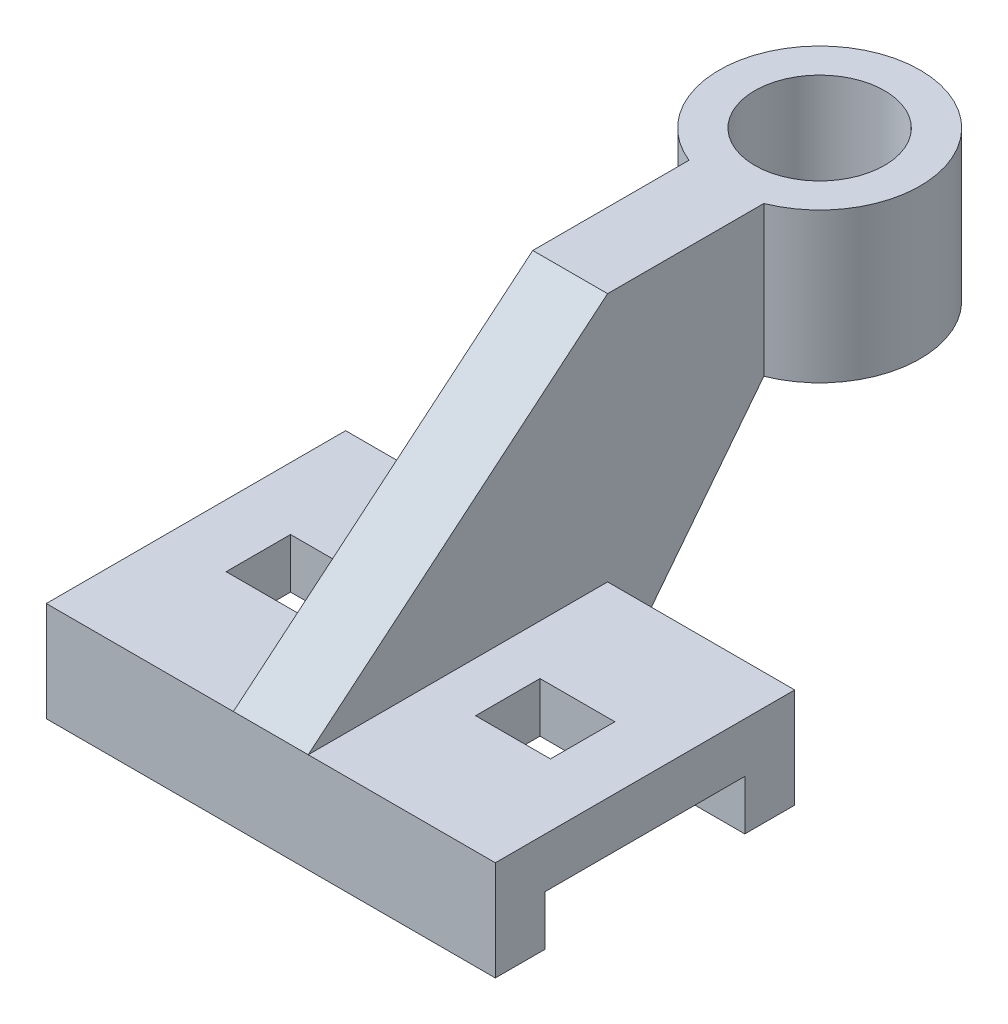
from build123d import *

# Parameters (mm, degrees)
SKETCH1_W                = 90
SKETCH1_H                = 20
BOSS_EXTRUDE1_DEPTH      = 60
SKETCH2_W                = 40
SKETCH2_H                = 10
CUT_EXTRUDE2_DEPTH       = 90
SKETCH3_W                = 15
SKETCH3_H                = 12.908253666
CUT_EXTRUDE4_DEPTH       = 30
BOSS_EXTRUDE7_DEPTH      = 10
BOSS_EXTRUDE7_DEPTH_BACK = 60
SKETCH4_W                = 15
SKETCH4_H                = 50.029295458
CUT_EXTRUDE7_DEPTH       = 15
SKETCH15_R               = 13
BOSS_EXTRUDE9_DEPTH      = 30
SKETCH28_W               = 15
SKETCH28_H               = 31.312087749
BOSS_EXTRUDE12_DEPTH     = 47
CUT_EXTRUDE10_DEPTH      = 15


with BuildPart() as part:
    # Sketch1 → Boss-Extrude1 (new body)
    with BuildSketch(Plane.XY):
        with Locations((5.654450262, 10)):
            Rectangle(SKETCH1_W, SKETCH1_H)
    extrude(amount=BOSS_EXTRUDE1_DEPTH)

    # Sketch2 → Cut-Extrude2 (cut)
    with BuildSketch(Plane(origin=(50.654450262, 0, 0), x_dir=(0, 0, -1), z_dir=(1, 0, 0))):
        with Locations((-30, 5)):
            Rectangle(SKETCH2_W, SKETCH2_H)
    extrude(amount=-CUT_EXTRUDE2_DEPTH, mode=Mode.SUBTRACT)

    # Sketch3 → Cut-Extrude4 (cut)
    with BuildSketch(Plane(origin=(0, 20, 0), x_dir=(1, 0, 0), z_dir=(0, 1, 0))):
        with Locations((-19.345549738, -30)):
            Rectangle(SKETCH3_W, SKETCH3_H)
        with Locations((30.654450262, -30)):
            Rectangle(SKETCH3_W, SKETCH3_H)
    extrude(amount=-CUT_EXTRUDE4_DEPTH, mode=Mode.SUBTRACT)

    # Sketch4 → Boss-Extrude7 (add, two sides: drawn at the far end of the back side and taken through both)
    with BuildSketch(Plane(origin=(0, 0, 0), x_dir=(-1, 0, 0), z_dir=(0, 0, -1)).offset(-BOSS_EXTRUDE7_DEPTH_BACK)):
        with Locations((-5.654450262, 45.014647729)):
            Rectangle(SKETCH4_W, SKETCH4_H)
    extrude(amount=BOSS_EXTRUDE7_DEPTH + BOSS_EXTRUDE7_DEPTH_BACK)

    # Sketch13 → Cut-Extrude7 (cut)
    with BuildSketch(Plane.ZY.offset(1.845549738)):
        Polygon((60, 20), (60, 70.029295458), (0, 70.029295458), align=None)
    extrude(amount=-CUT_EXTRUDE7_DEPTH, mode=Mode.SUBTRACT)

    # Sketch15 → Boss-Extrude9 (add)
    with BuildSketch(Plane(origin=(0, 70.029295458, 0), x_dir=(1, 0, 0), z_dir=(0, 1, 0))):
        with BuildLine():
            Line((-1.845549738, 10), (13.154450262, 10))
            Line((13.154450262, 10), (13.154450262, 31.312087749))
            ThreePointArc((13.154450262, 31.312087749), (5.654450262, 70.136734201), (-1.845549738, 31.312087749))
            Line((-1.845549738, 31.312087749), (-1.845549738, 10))
        make_face()
        with Locations(Location((5.654450262, 50, 0), (0, 0, 270))):
            Circle(SKETCH15_R, mode=Mode.SUBTRACT)
    extrude(amount=-BOSS_EXTRUDE9_DEPTH)

    # Sketch28 → Boss-Extrude12 (add)
    with BuildSketch(Plane.XZ):
        with Locations((5.654450262, -15.656043875)):
            Rectangle(SKETCH28_W, SKETCH28_H)
    extrude(amount=-BOSS_EXTRUDE12_DEPTH)

    # Sketch29 → Cut-Extrude10 (cut)
    with BuildSketch(Plane(origin=(13.154450262, 0, 0), x_dir=(0, 0, -1), z_dir=(1, 0, 0))):
        Polygon((31.312087749, 40.029295458), (0, 0), (31.312087749, 0), align=None)
    extrude(amount=-CUT_EXTRUDE10_DEPTH, mode=Mode.SUBTRACT)


solid = part.part
